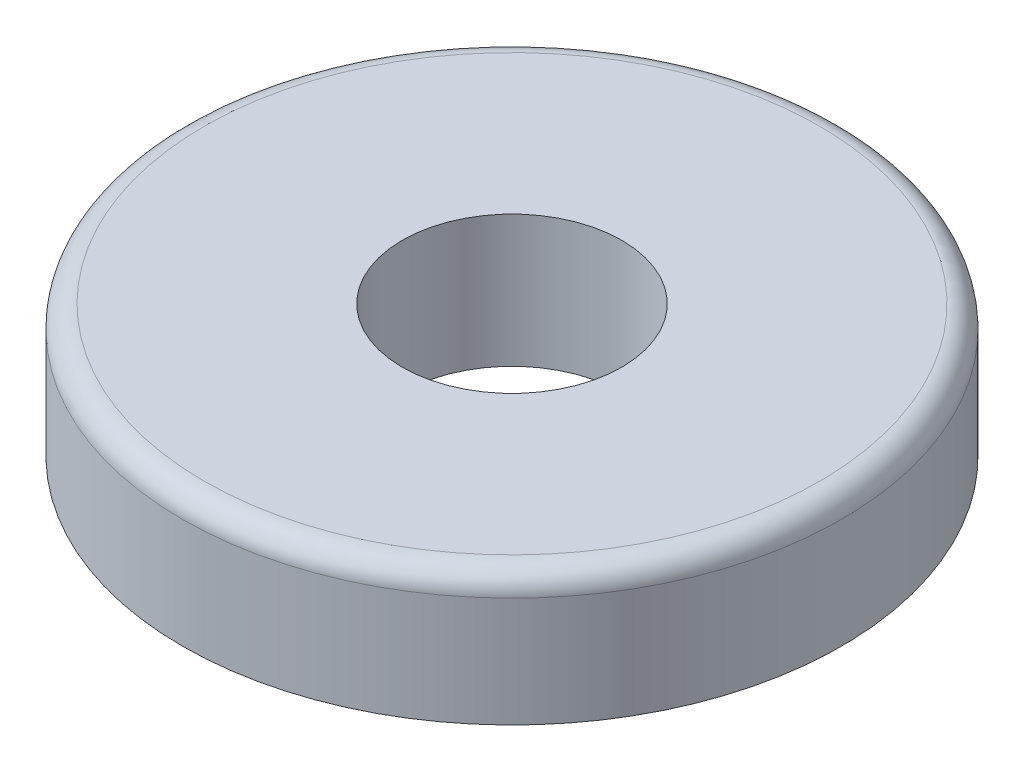
from build123d import *

# Parameters (mm, degrees)
ESQUISSE2_R        = 3.75
ESQUISSE2_R_2      = 1.25
BOSS_EXTRU_1_DEPTH = 1.5
CONG_2_R           = 0.25


with BuildPart() as part:
    # Esquisse2 → Boss.-Extru.1 (new body)
    with BuildSketch(Plane(origin=(0, 0, 0), x_dir=(1, 0, 0), z_dir=(0, 1, 0))):
        with Locations(Location((0, 0, 0), (0, 0, 270))):
            Circle(ESQUISSE2_R)
        with Locations(Location((0, 0, 0), (0, 0, 270))):
            Circle(ESQUISSE2_R_2, mode=Mode.SUBTRACT)
    extrude(amount=BOSS_EXTRU_1_DEPTH)

    # Congé2
    cong_2_edges = [part.edges().sort_by_distance(p)[0] for p in [
        (0, 1.5, -3.75),
    ]]
    fillet(cong_2_edges, radius=CONG_2_R)


solid = part.part
